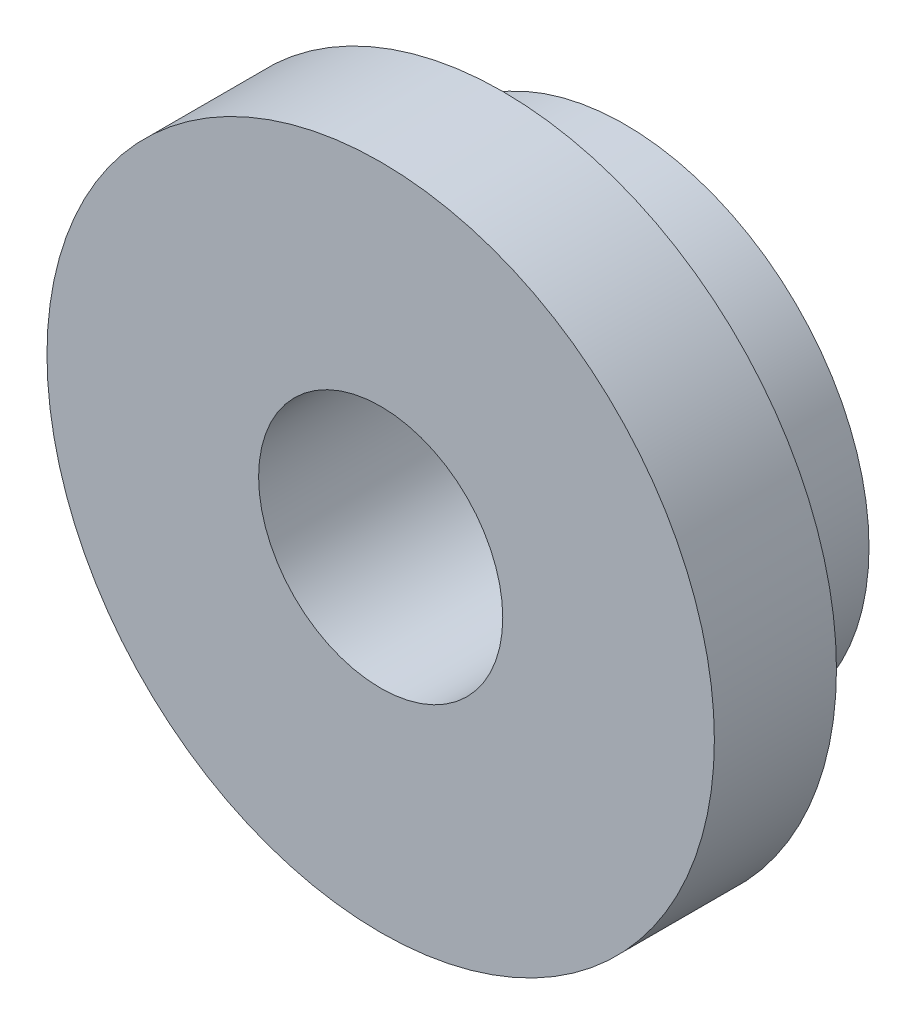
from build123d import *

# Parameters (mm, degrees)
SKETCH1_R           = 6.35
SKETCH1_R_2         = 3.175
BOSS_EXTRUDE1_DEPTH = 3.175
SKETCH2_R           = 8.678331539
SKETCH2_R_2         = 3.175
BOSS_EXTRUDE2_DEPTH = 3.175


with BuildPart() as part:
    # Sketch1 → Boss-Extrude1 (new body)
    with BuildSketch(Plane.XY):
        Circle(SKETCH1_R)
        Circle(SKETCH1_R_2, mode=Mode.SUBTRACT)
    extrude(amount=BOSS_EXTRUDE1_DEPTH)

    # Sketch2 → Boss-Extrude2 (add)
    with BuildSketch(Plane.XY.offset(3.175)):
        Circle(SKETCH2_R)
        Circle(SKETCH2_R_2, mode=Mode.SUBTRACT)
    extrude(amount=BOSS_EXTRUDE2_DEPTH)


solid = part.part
